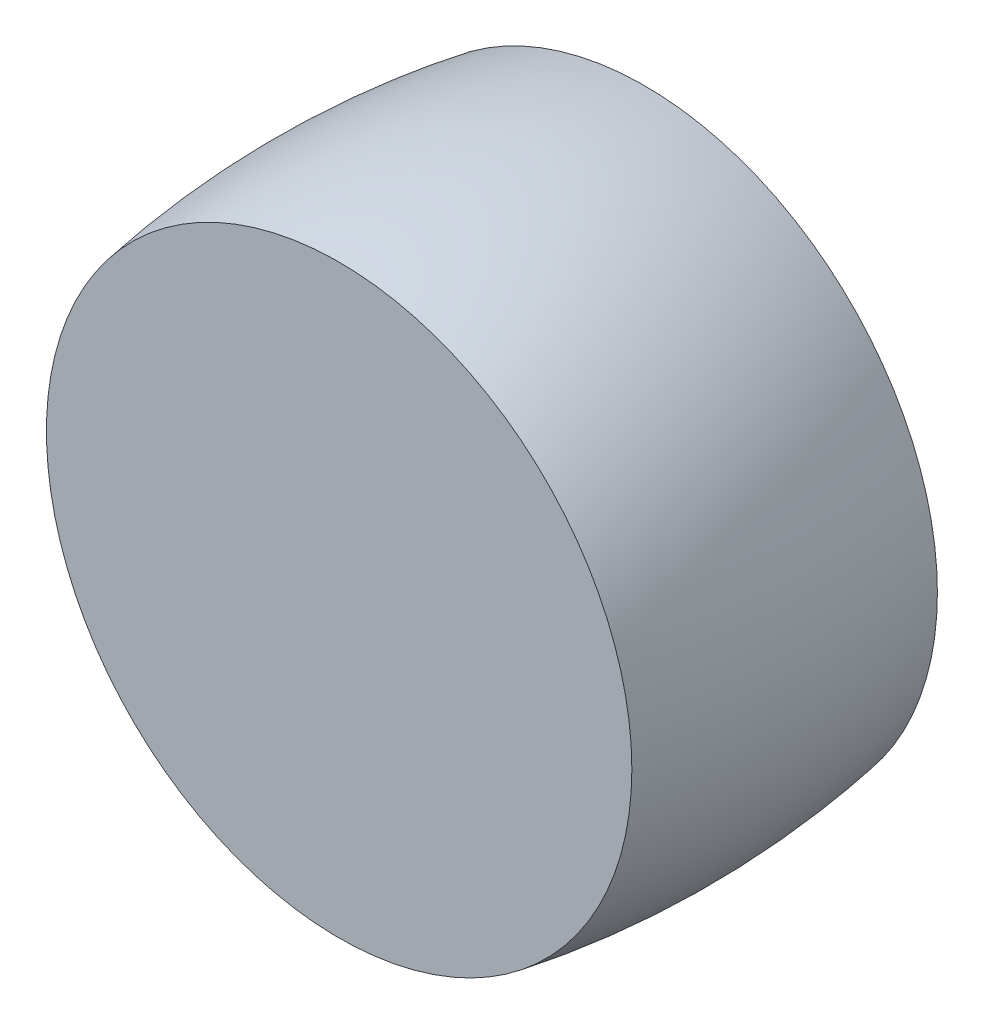
from build123d import *


with BuildPart() as part:
    # 草图2 → 旋转1 (revolve)
    with BuildSketch(Plane(origin=(0, 0, 0), x_dir=(1, 0, 0), z_dir=(0, 1, 0))):
        with BuildLine():
            Line((0, -20), (38.321595814, -20))
            ThreePointArc((38.321595814, -20), (40, 1.3e-08), (38.32159551, 20))
            Line((38.32159551, 20), (0, 20))
            Line((0, 20), (0, -20))
        make_face()
    revolve(axis=Axis((0, 0, 57.564055542), (0, 0, -1)))


solid = part.part
